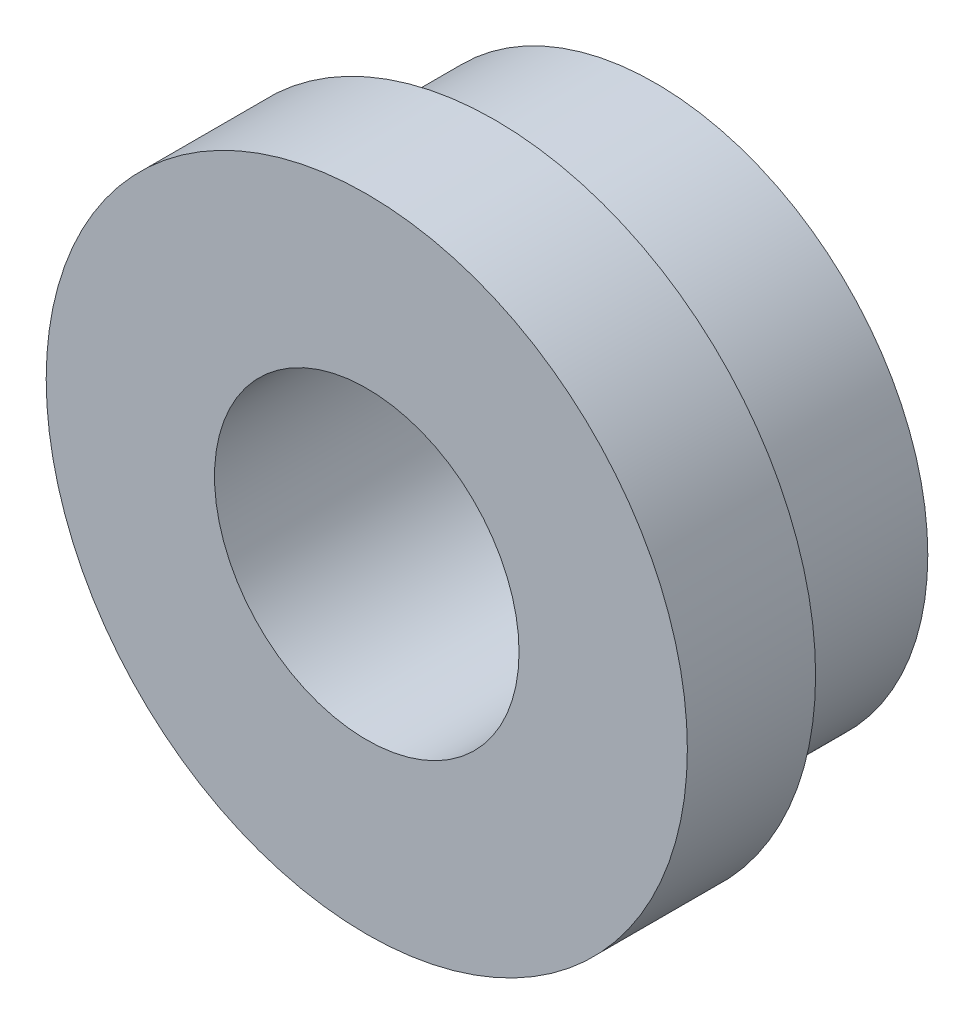
from build123d import *

# Parameters (mm, degrees)
SKETCH1_R           = 17
SKETCH1_R_2         = 9.5
BOSS_EXTRUDE1_DEPTH = 10
SKETCH2_R           = 20
SKETCH2_R_2         = 9.5
BOSS_EXTRUDE2_DEPTH = 8
CHAMFER1_SIZE       = 2
FILLET1_R           = 2


with BuildPart() as part:
    # Sketch1 → Boss-Extrude1 (new body)
    with BuildSketch(Plane.XY):
        Circle(SKETCH1_R)
        Circle(SKETCH1_R_2, mode=Mode.SUBTRACT)
    extrude(amount=BOSS_EXTRUDE1_DEPTH)

    # Sketch2 → Boss-Extrude2 (add)
    with BuildSketch(Plane.XY.offset(10)):
        Circle(SKETCH2_R)
        Circle(SKETCH2_R_2, mode=Mode.SUBTRACT)
    extrude(amount=BOSS_EXTRUDE2_DEPTH)

    # Chamfer1
    chamfer1_edges = [part.edges().sort_by_distance(p)[0] for p in [
        (-9.5, 0, 0),
    ]]
    chamfer(chamfer1_edges, length=CHAMFER1_SIZE)

    # Fillet1
    fillet1_edges = [part.edges().sort_by_distance(p)[0] for p in [
        (-9.5, 0, 2),
    ]]
    fillet(fillet1_edges, radius=FILLET1_R)


solid = part.part
